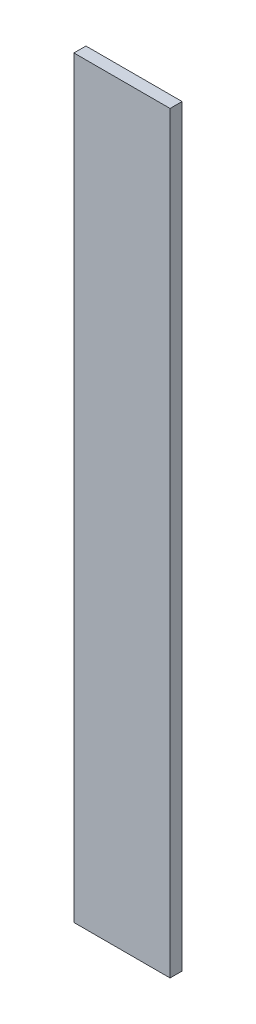
from build123d import *

# Parameters (mm, degrees)
SKETCH_1_W         = 24
SKETCH_1_H         = 188
BLOCKEXTRUDE_DEPTH = 3


with BuildPart() as part:
    # 草图1 → BlockExtrude (new body)
    with BuildSketch(Plane.XY):
        with Locations((12, 94)):
            Rectangle(SKETCH_1_W, SKETCH_1_H)
    extrude(amount=BLOCKEXTRUDE_DEPTH)


solid = part.part
